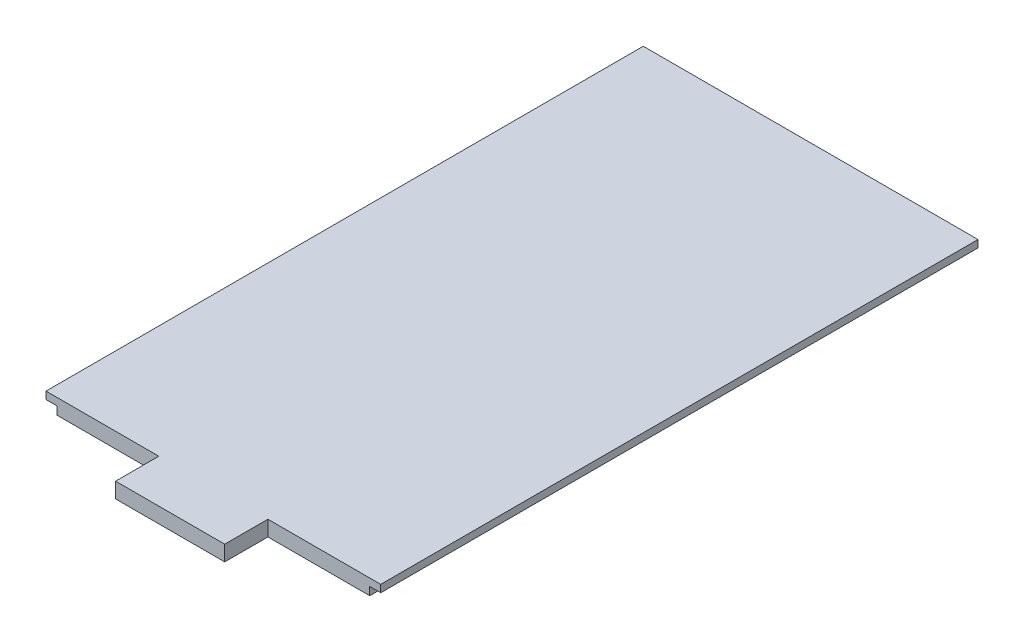
from build123d import *

# Parameters (mm, degrees)
BOSS_EXTRUDE1_DEPTH = 163.1
SKETCH3_W           = 29.8
SKETCH3_H           = 11.8
BOSS_EXTRUDE2_DEPTH = 4.2


with BuildPart() as part:
    # Sketch2 → Boss-Extrude1 (new body)
    with BuildSketch(Plane.XY):
        Polygon((42.7, 0), (-42.7, 0), (-42.7, 2.2), (-45.7, 2.2), (-45.7, 4.2), (45.7, 4.2), (45.7, 2.2), (42.7, 2.2), align=None)
    extrude(amount=BOSS_EXTRUDE1_DEPTH)

    # Sketch3 → Boss-Extrude2 (add)
    with BuildSketch(Plane.XZ):
        with Locations((0, 169)):
            Rectangle(SKETCH3_W, SKETCH3_H)
    extrude(amount=-BOSS_EXTRUDE2_DEPTH)


solid = part.part
